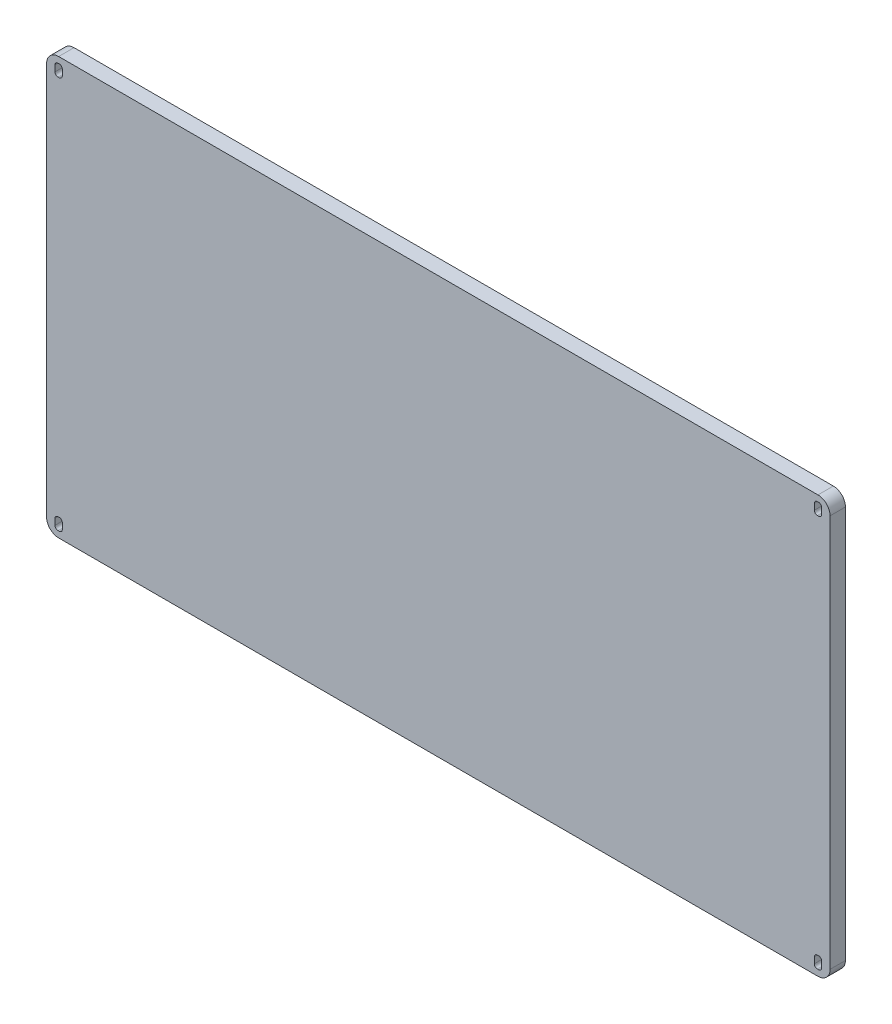
from build123d import *

# Parameters (mm, degrees)
SKETCH1_W           = 647.7
SKETCH1_H           = 344.678
BOSS_EXTRUDE1_DEPTH = 12.7
FILLET1_R           = 10
FILLET2_R           = 10


with BuildPart() as part:
    # Sketch1 → Boss-Extrude1 (new body)
    with BuildSketch(Plane.XY):
        with Locations((25.51036036, -39.985171171)):
            Rectangle(SKETCH1_W, SKETCH1_H)
        with BuildLine():
            Line((339.86036036, -207.324171171), (338.86036036, -207.324171171))
            ThreePointArc((338.86036036, -207.324171171), (337.092593407, -206.591938124), (336.36036036, -204.824171171))
            Line((336.36036036, -204.824171171), (336.36036036, -199.824171171))
            ThreePointArc((336.36036036, -199.824171171), (337.092593407, -198.056404218), (338.86036036, -197.324171171))
            Line((338.86036036, -197.324171171), (339.86036036, -197.324171171))
            ThreePointArc((339.86036036, -197.324171171), (341.628127313, -198.056404218), (342.36036036, -199.824171171))
            Line((342.36036036, -199.824171171), (342.36036036, -204.824171171))
            ThreePointArc((342.36036036, -204.824171171), (341.628127313, -206.591938124), (339.86036036, -207.324171171))
        make_face(mode=Mode.SUBTRACT)
        with BuildLine():
            Line((-287.83963964, -207.324171171), (-288.83963964, -207.324171171))
            ThreePointArc((-288.83963964, -207.324171171), (-290.607406593, -206.591938124), (-291.33963964, -204.824171171))
            Line((-291.33963964, -204.824171171), (-291.33963964, -199.824171171))
            ThreePointArc((-291.33963964, -199.824171171), (-290.607406593, -198.056404218), (-288.83963964, -197.324171171))
            Line((-288.83963964, -197.324171171), (-287.83963964, -197.324171171))
            ThreePointArc((-287.83963964, -197.324171171), (-286.071872687, -198.056404218), (-285.33963964, -199.824171171))
            Line((-285.33963964, -199.824171171), (-285.33963964, -204.824171171))
            ThreePointArc((-285.33963964, -204.824171171), (-286.071872687, -206.591938124), (-287.83963964, -207.324171171))
        make_face(mode=Mode.SUBTRACT)
        with BuildLine():
            Line((-287.83963964, 117.355828829), (-288.83963964, 117.355828829))
            ThreePointArc((-288.83963964, 117.355828829), (-290.607406593, 118.088061876), (-291.33963964, 119.855828829))
            Line((-291.33963964, 119.855828829), (-291.33963964, 124.855828829))
            ThreePointArc((-291.33963964, 124.855828829), (-290.607406593, 126.623595782), (-288.83963964, 127.355828829))
            Line((-288.83963964, 127.355828829), (-287.83963964, 127.355828829))
            ThreePointArc((-287.83963964, 127.355828829), (-286.071872687, 126.623595782), (-285.33963964, 124.855828829))
            Line((-285.33963964, 124.855828829), (-285.33963964, 119.855828829))
            ThreePointArc((-285.33963964, 119.855828829), (-286.071872687, 118.088061876), (-287.83963964, 117.355828829))
        make_face(mode=Mode.SUBTRACT)
        with BuildLine():
            Line((339.86036036, 117.355828829), (338.86036036, 117.355828829))
            ThreePointArc((338.86036036, 117.355828829), (337.092593407, 118.088061876), (336.36036036, 119.855828829))
            Line((336.36036036, 119.855828829), (336.36036036, 124.855828829))
            ThreePointArc((336.36036036, 124.855828829), (337.092593407, 126.623595782), (338.86036036, 127.355828829))
            Line((338.86036036, 127.355828829), (339.86036036, 127.355828829))
            ThreePointArc((339.86036036, 127.355828829), (341.628127313, 126.623595782), (342.36036036, 124.855828829))
            Line((342.36036036, 124.855828829), (342.36036036, 119.855828829))
            ThreePointArc((342.36036036, 119.855828829), (341.628127313, 118.088061876), (339.86036036, 117.355828829))
        make_face(mode=Mode.SUBTRACT)
    extrude(amount=BOSS_EXTRUDE1_DEPTH)

    # Fillet1
    fillet1_edges = [part.edges().sort_by_distance(p)[0] for p in [
        (-298.33963964, 132.353828829, 6.35),
        (349.36036036, 132.353828829, 6.35),
        (349.36036036, -212.324171171, 6.35),
    ]]
    fillet(fillet1_edges, radius=FILLET1_R)

    # Fillet2
    fillet2_edges = [part.edges().sort_by_distance(p)[0] for p in [
        (-298.33963964, -212.324171171, 6.35),
    ]]
    fillet(fillet2_edges, radius=FILLET2_R)


solid = part.part
